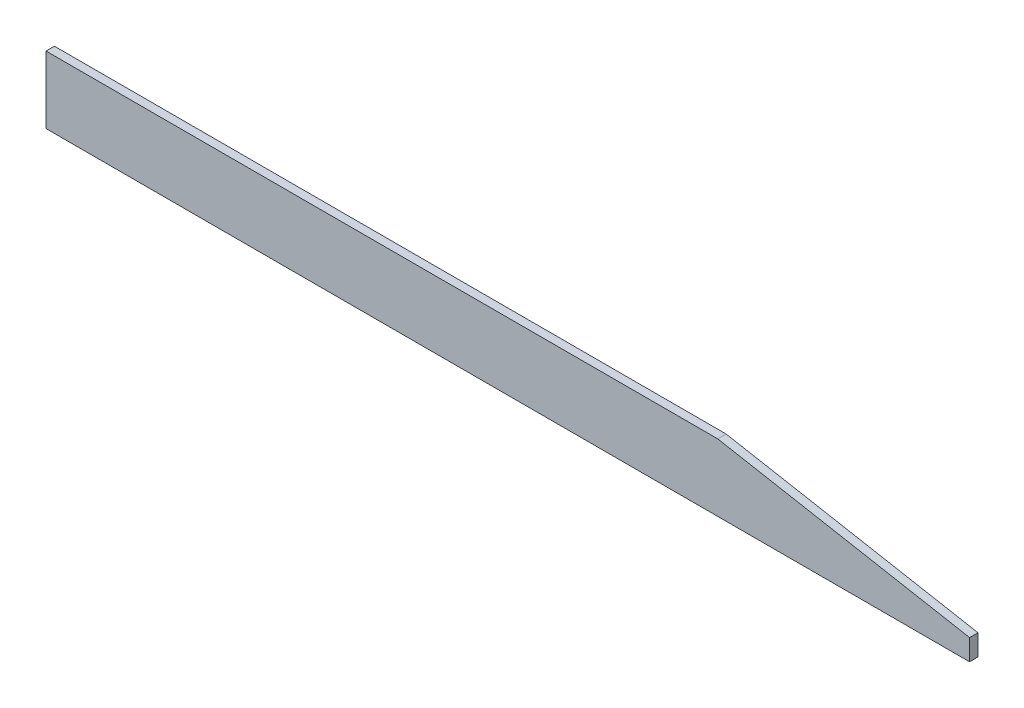
from build123d import *

# Parameters (mm, degrees)
BOSS_EXTRU_1_DEPTH = 2


with BuildPart() as part:
    # Esquisse1 → Boss.-Extru.1 (new body)
    with BuildSketch(Plane.XY):
        Polygon((0, 0), (220, 0), (220, 5), (160, 16), (0, 16), align=None)
    extrude(amount=BOSS_EXTRU_1_DEPTH)


solid = part.part
